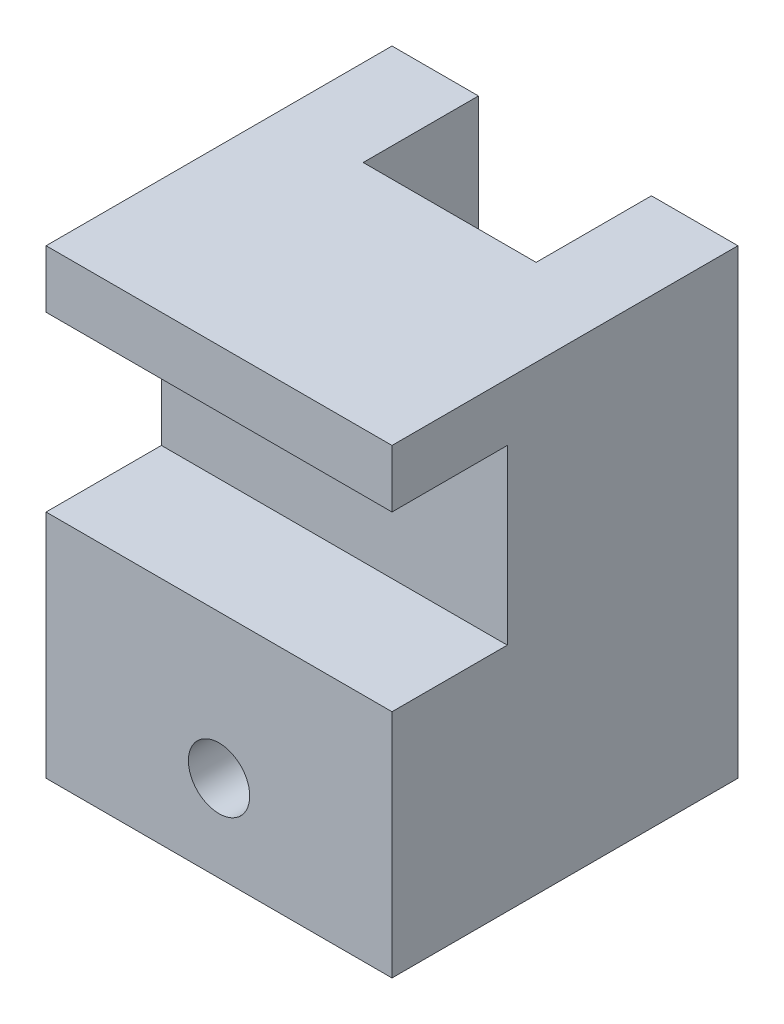
from build123d import *

# Parameters (mm, degrees)
SKETCH1_W                 = 38.1
SKETCH1_H                 = 50.8
BOSS_EXTRUDE1_DEPTH       = 19.05
SKETCH2_W                 = 19.05
SKETCH2_H                 = 50.8
CUT_EXTRUDE1_DEPTH        = 12.7
SKETCH3_W                 = 38.1
SKETCH3_H                 = 19.05
CUT_EXTRUDE2_DEPTH        = 12.7
F_1_4_CLEARANCE_HOLE1_D   = 6.7564
F_8_32_TAPPED_HOLE1_D     = 3.4544
F_8_32_TAPPED_HOLE1_DEPTH = 10.668
F_8_32_TAPPED_HOLE1_TIP   = 1.037806461


with BuildPart() as part:
    # Sketch1 → Boss-Extrude1 (new, symmetric)
    with BuildSketch(Plane.XY):
        Rectangle(SKETCH1_W, SKETCH1_H)
    extrude(amount=BOSS_EXTRUDE1_DEPTH, both=True)

    # Sketch2 → Cut-Extrude1 (cut)
    with BuildSketch(Plane(origin=(0, 0, -19.05), x_dir=(-1, 0, 0), z_dir=(0, 0, -1))):
        Rectangle(SKETCH2_W, SKETCH2_H)
    extrude(amount=-CUT_EXTRUDE1_DEPTH, mode=Mode.SUBTRACT)

    # Sketch3 → Cut-Extrude2 (cut)
    with BuildSketch(Plane.XY.offset(19.05)):
        with Locations((0, 9.525)):
            Rectangle(SKETCH3_W, SKETCH3_H)
    extrude(amount=-CUT_EXTRUDE2_DEPTH, mode=Mode.SUBTRACT)

    # 1/4 Clearance Hole1 (through all)
    with Locations(Plane.XY.offset(19.05)):
        with Locations((0, -15.875)):
            Hole(F_1_4_CLEARANCE_HOLE1_D / 2)

    # #8-32 Tapped Hole1
    with Locations(Plane.XY.offset(6.35)):
        with Locations((0, 9.525)):
            Hole(F_8_32_TAPPED_HOLE1_D / 2, depth=F_8_32_TAPPED_HOLE1_DEPTH)
            with Locations((0, 0, -(F_8_32_TAPPED_HOLE1_DEPTH + F_8_32_TAPPED_HOLE1_TIP / 2))):  # 118° drill point
                Cone(0, F_8_32_TAPPED_HOLE1_D / 2, F_8_32_TAPPED_HOLE1_TIP, mode=Mode.SUBTRACT)


solid = part.part
